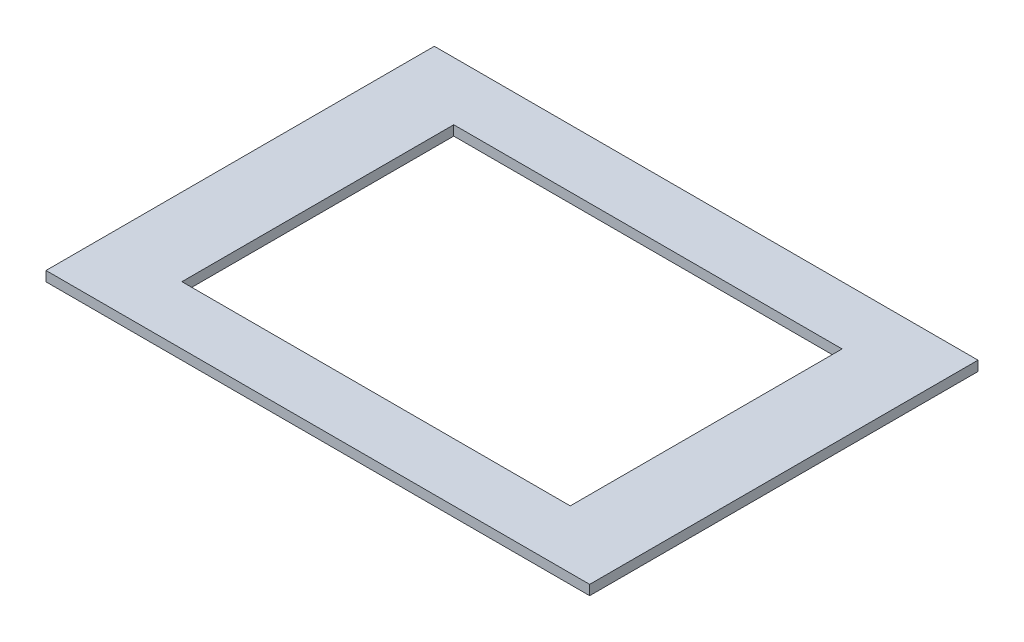
from build123d import *

# Parameters (mm, degrees)
SKETCH1_W           = 700
SKETCH1_H           = 500
BOSS_EXTRUDE1_DEPTH = 12.7
SKETCH2_W           = 500
SKETCH2_H           = 350
CUT_EXTRUDE1_DEPTH  = 861.326269505


with BuildPart() as part:
    # Sketch1 → Boss-Extrude1 (new body)
    with BuildSketch(Plane(origin=(0, 0, 0), x_dir=(1, 0, 0), z_dir=(0, 1, 0))):
        with Locations((350, 250)):
            Rectangle(SKETCH1_W, SKETCH1_H)
    extrude(amount=BOSS_EXTRUDE1_DEPTH)

    # Sketch2 → Cut-Extrude1 (cut, through all)
    with BuildSketch(Plane(origin=(0, 12.7, 0), x_dir=(1, 0, 0), z_dir=(0, 1, 0))):
        with Locations((350, 250)):
            Rectangle(SKETCH2_W, SKETCH2_H)
    extrude(amount=-CUT_EXTRUDE1_DEPTH, mode=Mode.SUBTRACT)


solid = part.part
